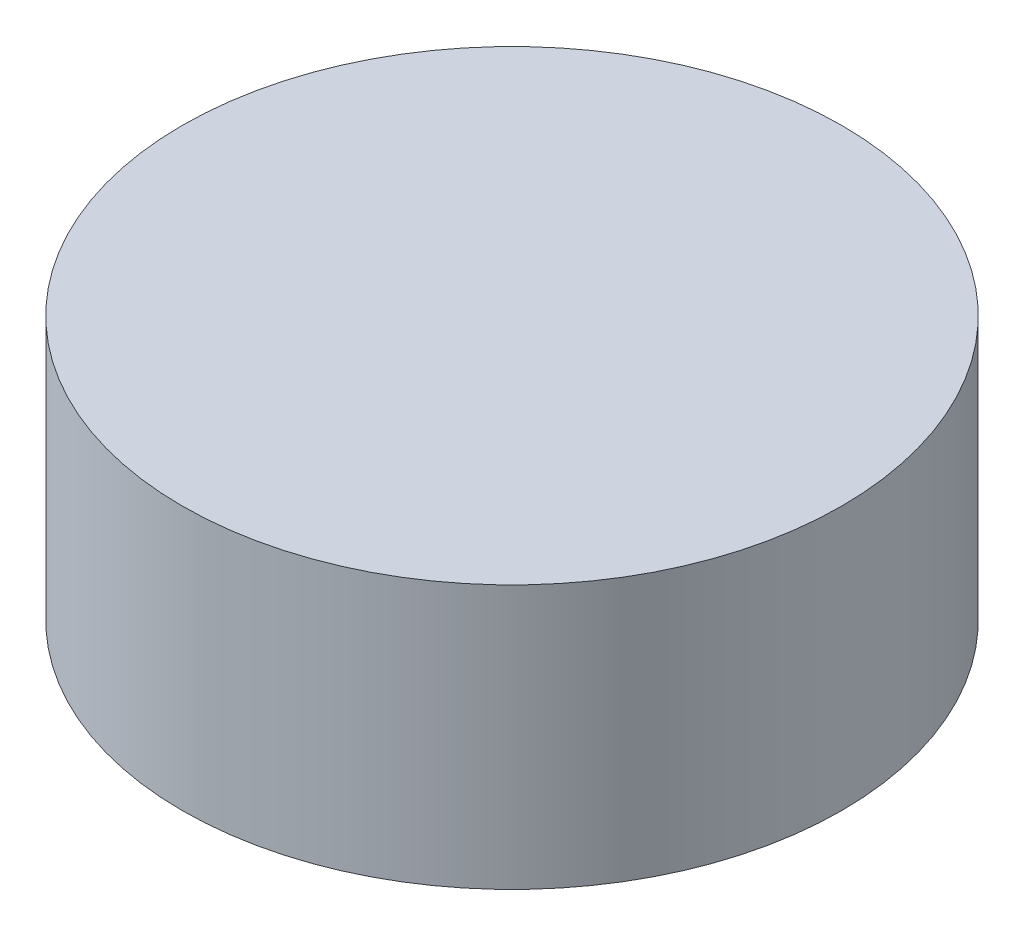
from build123d import *

# Parameters (mm, degrees)
SKETCH1_R           = 31.75
BOSS_EXTRUDE1_DEPTH = 25.4


with BuildPart() as part:
    # Sketch1 → Boss-Extrude1 (new body)
    with BuildSketch(Plane(origin=(0, 0, 0), x_dir=(1, 0, 0), z_dir=(0, 1, 0))):
        with Locations(Location((0, 0, 0), (0, 0, 270))):
            Circle(SKETCH1_R)
    extrude(amount=BOSS_EXTRUDE1_DEPTH)


solid = part.part
